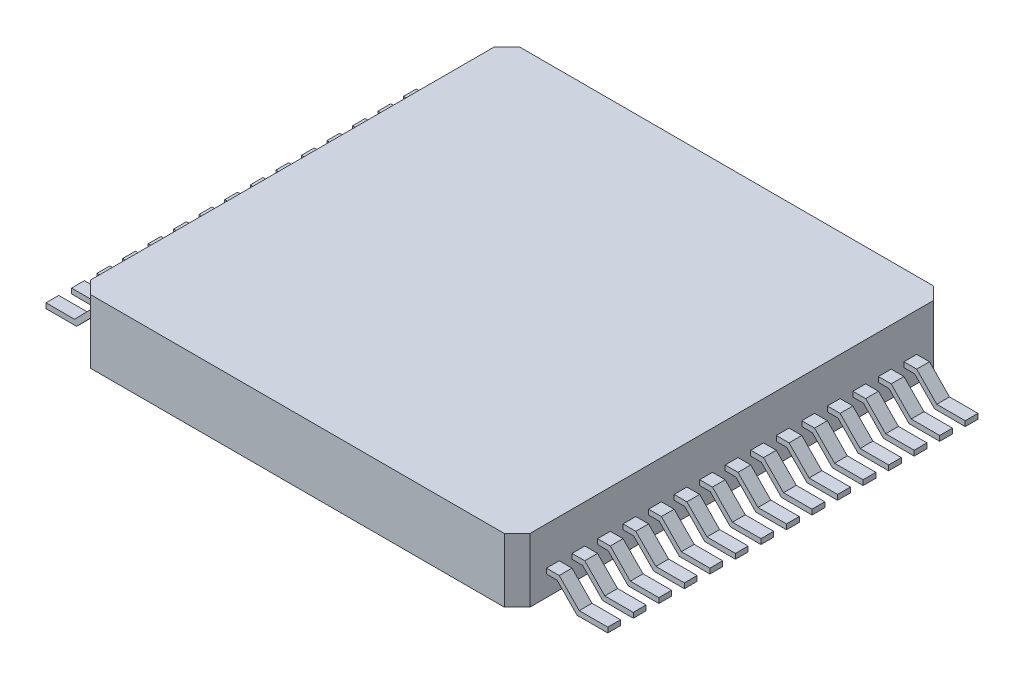
from build123d import *

# Parameters (mm, degrees)
SALIENTE_EXTRUIR1_DEPTH = 2.5
SALIENTE_EXTRUIR2_DEPTH = 0.5
MATRIZL1_COUNT          = 15
MATRIZL1_PITCH          = 1


with BuildPart() as part:
    # Croquis1 → Saliente-Extruir1 (new body)
    with BuildSketch(Plane(origin=(0, 0, 0), x_dir=(1, 0, 0), z_dir=(0, 1, 0))):
        Polygon((-8.1, 8.4), (-8.6, 7.9), (-8.6, -7.9), (-8.1, -8.4), (8.1, -8.4), (8.6, -7.9), (8.6, 7.9), (8.1, 8.4), align=None)
    extrude(amount=SALIENTE_EXTRUIR1_DEPTH)

    # Croquis2 → Saliente-Extruir2 (add)
    with BuildSketch(Plane.XY.offset(7.25)):
        Polygon((8.6, 0.8), (9.015973424, 0.8), (9.8, 0), (11, 0), (11, 0.2), (9.884026576, 0.2), (9.1, 1), (8.6, 1), align=None)
        Polygon((-11, 0), (-11, 0.2), (-9.884026576, 0.2), (-9.1, 1), (-8.6, 1), (-8.6, 0.8), (-9.015973424, 0.8), (-9.8, 0), align=None)
    saliente_extruir2 = extrude(amount=-SALIENTE_EXTRUIR2_DEPTH)

    # MatrizL1: Saliente-Extruir2 ×15
    with Locations(*[(0, 0, -i * MATRIZL1_PITCH) for i in range(1, MATRIZL1_COUNT)]):
        add(saliente_extruir2)


solid = part.part
